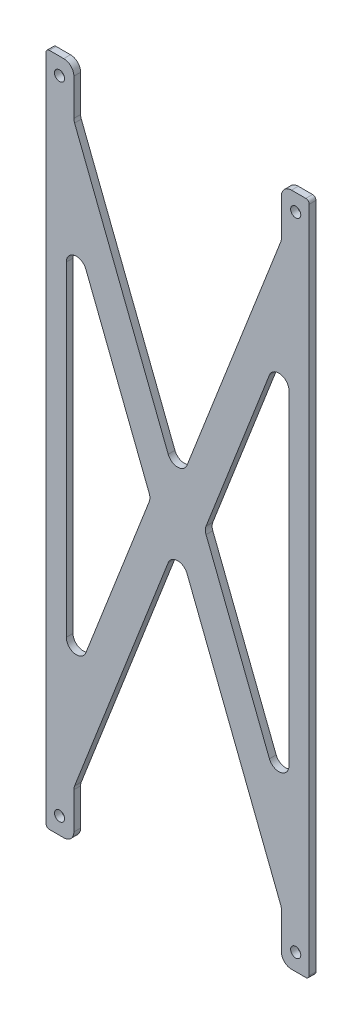
from build123d import *

# Parameters (mm, degrees)
EXTRUDE_1_DEPTH     = 2
SKETCH_4_R          = 1.5
CUT_EXTRUDE_3_DEPTH = 108.354552768
FILLET_4_R          = 1
CUT_EXTRUDE_5_DEPTH = 108.354552768
FILLET_7_R          = 3


with BuildPart() as part:
    # 草图1 → 凸台-拉伸1 (new body)
    with BuildSketch(Plane.XY):
        Polygon((39, 79.487179487), (33, 64.102564103), (33, -64.102564103), (39, -79.487179487), align=None)
        Polygon((33, -64.102564103), (8, 0), (0, -20.512820513), (31, -100), (39, -100), (39, -79.487179487), align=None)
        Polygon((-31, -100), (0, -20.512820513), (-8, 0), (-33, -64.102564103), (-39, -79.487179487), (-39, -100), align=None)
        Polygon((-33, -64.102564103), (-33, 64.102564103), (-39, 79.487179487), (-39, -79.487179487), align=None)
        Polygon((0, -20.512820513), (8, 0), (0, 20.512820513), (-8, 0), align=None)
        Polygon((8, 0), (33, 64.102564103), (39, 79.487179487), (39, 100), (31, 100), (0, 20.512820513), align=None)
        Polygon((-8, 0), (0, 20.512820513), (-31, 100), (-39, 100), (-39, 79.487179487), (-33, 64.102564103), align=None)
    extrude(amount=EXTRUDE_1_DEPTH)

    # 草图4 → 切除-拉伸3 (cut, through all)
    with BuildSketch(Plane.XY.offset(2)):
        with Locations((-35, 95)):
            Circle(SKETCH_4_R)
        with Locations(Location((-35, -95, 0), (0, 0, 180))):
            Circle(SKETCH_4_R)
        with Locations((35, -95)):
            Circle(SKETCH_4_R)
        with Locations(Location((35, 95, 0), (0, 0, 180))):
            Circle(SKETCH_4_R)
    extrude(amount=-CUT_EXTRUDE_3_DEPTH, mode=Mode.SUBTRACT)

    # 圆角4
    fillet_4_edges = [part.edges().sort_by_distance(p)[0] for p in [
        (39, -100, 1),
        (31, -100, 1),
        (-31, -100, 1),
        (-39, -100, 1),
        (-39, 100, 1),
        (-31, 100, 1),
        (31, 100, 1),
        (39, 100, 1),
    ]]
    fillet(fillet_4_edges, radius=FILLET_4_R)

    # 草图6 → 切除-拉伸5 (cut, through all)
    with BuildSketch(Plane.XY.offset(2)):
        Polygon((-30.751704658, -85.602329726), (-30.751704658, -99.363345276), (0, -20.512820513), (30.751704658, -99.363345276), (30.751704658, -85.602329726), (0, -6.751804962), align=None)
        Polygon((30.751704658, 85.602329726), (30.751704658, 99.363345276), (0, 20.512820513), (-30.751704658, 99.363345276), (-30.751704658, 85.602329726), (0, 6.751804962), align=None)
    extrude(amount=-CUT_EXTRUDE_5_DEPTH, mode=Mode.SUBTRACT)

    # 圆角7
    fillet_7_edges = [part.edges().sort_by_distance(p)[0] for p in [
        (30.751704658, 85.602329726, 1),
        (0, 6.751804962, 1),
        (-30.751704658, 85.602329726, 1),
        (-30.751704658, 99.363345276, 1),
        (-30.751704658, -99.363345276, 1),
        (0, -6.751804962, 1),
        (30.751704658, -85.602329726, 1),
        (30.751704658, -99.363345276, 1),
        (30.751704658, 99.363345276, 1),
        (33, 64.102564103, 1),
        (33, -64.102564103, 1),
        (8, 0, 1),
        (-8, 0, 1),
        (-33, -64.102564103, 1),
        (-33, 64.102564103, 1),
        (-30.751704658, -85.602329726, 1),
    ]]
    fillet(fillet_7_edges, radius=FILLET_7_R)


solid = part.part
